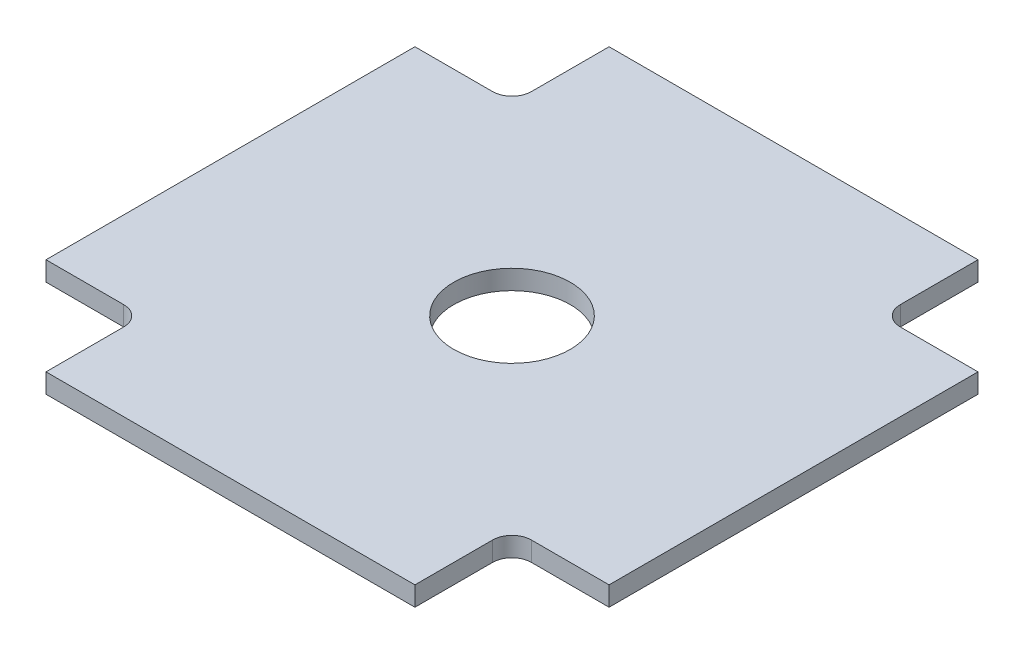
from build123d import *

# Parameters (mm, degrees)
SKETCH2_R           = 3
BOSS_EXTRUDE1_DEPTH = 1
FILLET1_R           = 1


with BuildPart() as part:
    # Sketch2 → Boss-Extrude1 (new body)
    with BuildSketch(Plane(origin=(0, 0, 0), x_dir=(1, 0, 0), z_dir=(0, 1, 0))):
        Polygon((0, 24), (5, 24), (5, 29), (24, 29), (24, 24), (29, 24), (29, 5), (24, 5), (24, 0), (5, 0), (5, 5), (0, 5), align=None)
        with Locations(Location((14.5, 14.5, 0), (0, 0, 270))):
            Circle(SKETCH2_R, mode=Mode.SUBTRACT)
    extrude(amount=BOSS_EXTRUDE1_DEPTH)

    # Fillet1
    fillet1_edges = [part.edges().sort_by_distance(p)[0] for p in [
        (5, 0.5, -24),
        (24, 0.5, -24),
        (24, 0.5, -5),
        (5, 0.5, -5),
    ]]
    fillet(fillet1_edges, radius=FILLET1_R)


solid = part.part
